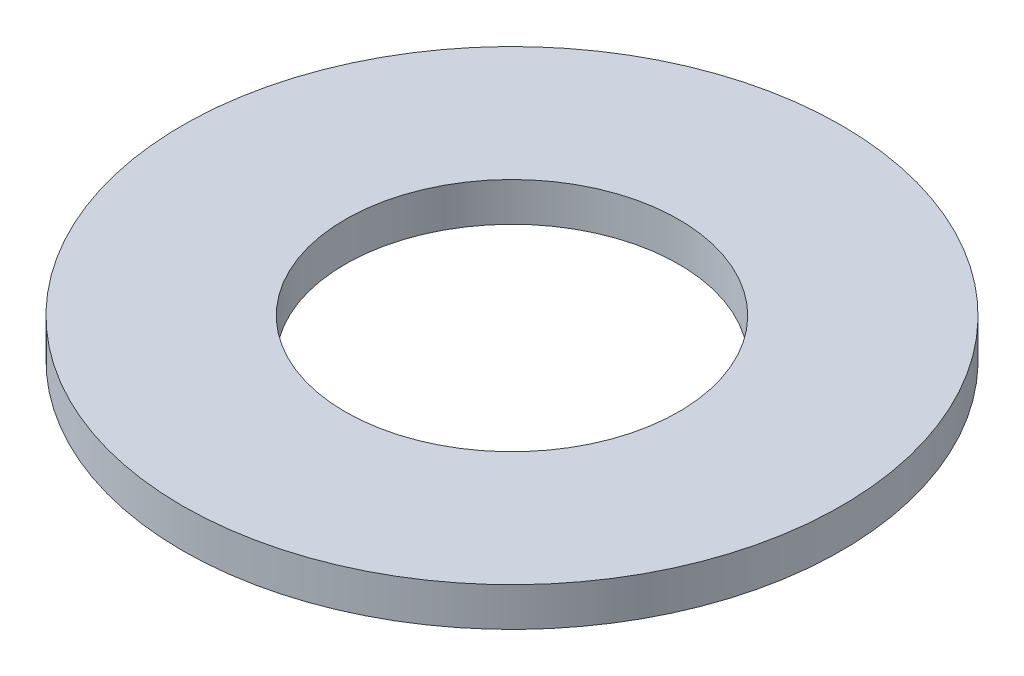
from build123d import *

# Parameters (mm, degrees)
SKETCH_1_R      = 4.25
SKETCH_1_R_2    = 2.15
EXTRUDE_1_DEPTH = 0.5


with BuildPart() as part:
    # 草图1 → 凸台-拉伸1 (new body)
    with BuildSketch(Plane(origin=(0, 0, 0), x_dir=(1, 0, 0), z_dir=(0, 1, 0))):
        with Locations(Location((0, 0, 0), (0, 0, 270))):
            Circle(SKETCH_1_R)
        with Locations(Location((0, 0, 0), (0, 0, 270))):
            Circle(SKETCH_1_R_2, mode=Mode.SUBTRACT)
    extrude(amount=EXTRUDE_1_DEPTH)


solid = part.part
